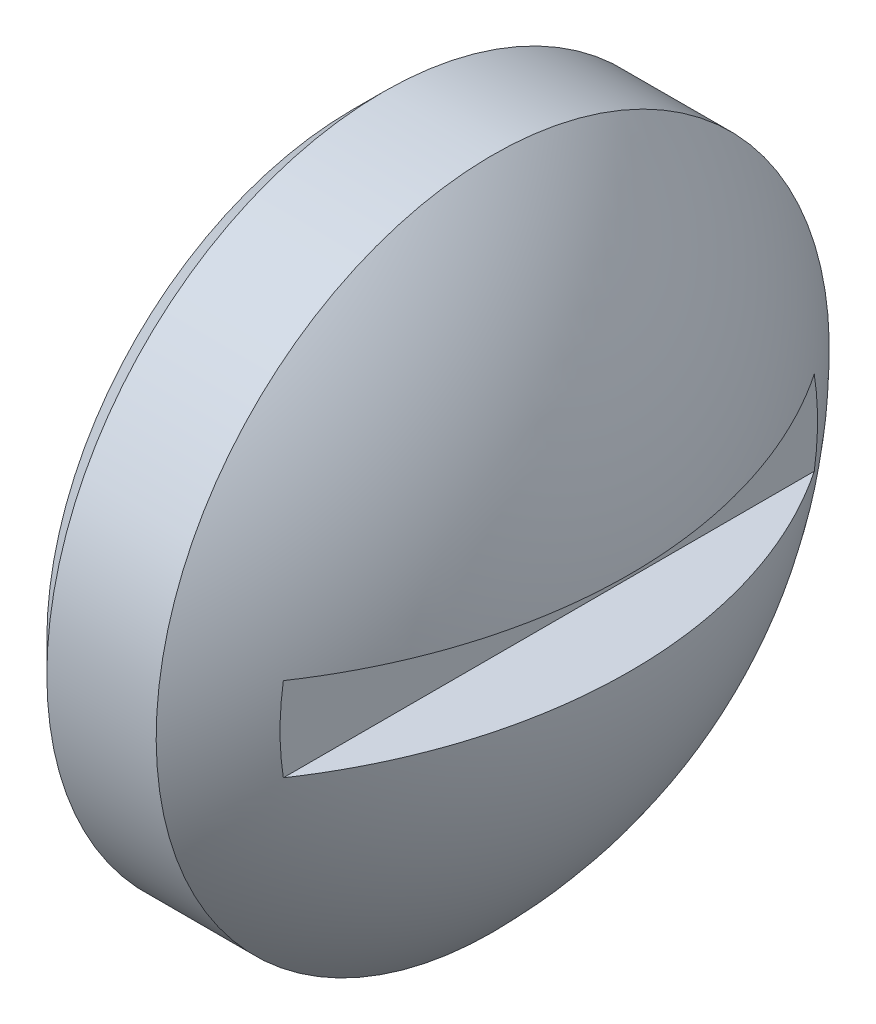
from build123d import *

# Parameters (mm, degrees)
CHAMFER_1_SIZE      = 1.1015
SKETCH_2_W          = 50
SKETCH_2_H          = 3
CUT_EXTRUDE_1_DEPTH = 19.357559751


with BuildPart() as part:
    # Эскиз1 → Повернуть1 (revolve)
    with BuildSketch(Plane.XY, mode=Mode.PRIVATE) as revolve_1_sk:
        with BuildLine():
            Line((0, 12), (5, 12))
            ThreePointArc((5, 12), (8.36795896, 7.179530606), (9.892099643, 1.5))
            Line((9.892099643, 1.5), (7, 1.5))
            Line((7, 1.5), (7, 0))
            Line((7, 0), (3.5, 0))
            Line((3.5, 0), (3.5, 7.5))
            Line((3.5, 7.5), (0, 7.5))
            Line((0, 7.5), (0, 12))
        make_face()
    revolve(revolve_1_sk.sketch.rotate(Axis((0, 0, 0), (1, 0, 0)), 180), axis=Axis((0, 0, 0), (1, 0, 0)))

    # Фаска1
    chamfer_1_edges = [part.edges().sort_by_distance(p)[0] for p in [
        (0, 12, 0),
    ]]
    chamfer(chamfer_1_edges, length=CHAMFER_1_SIZE)

    # Эскиз2 → Вырез-Вытянуть1 (cut, through all)
    with BuildSketch(Plane(origin=(7, 0, 0), x_dir=(0, 0, -1), z_dir=(1, 0, 0))):
        Rectangle(SKETCH_2_W, SKETCH_2_H)
    extrude(amount=CUT_EXTRUDE_1_DEPTH, mode=Mode.SUBTRACT)


solid = part.part
